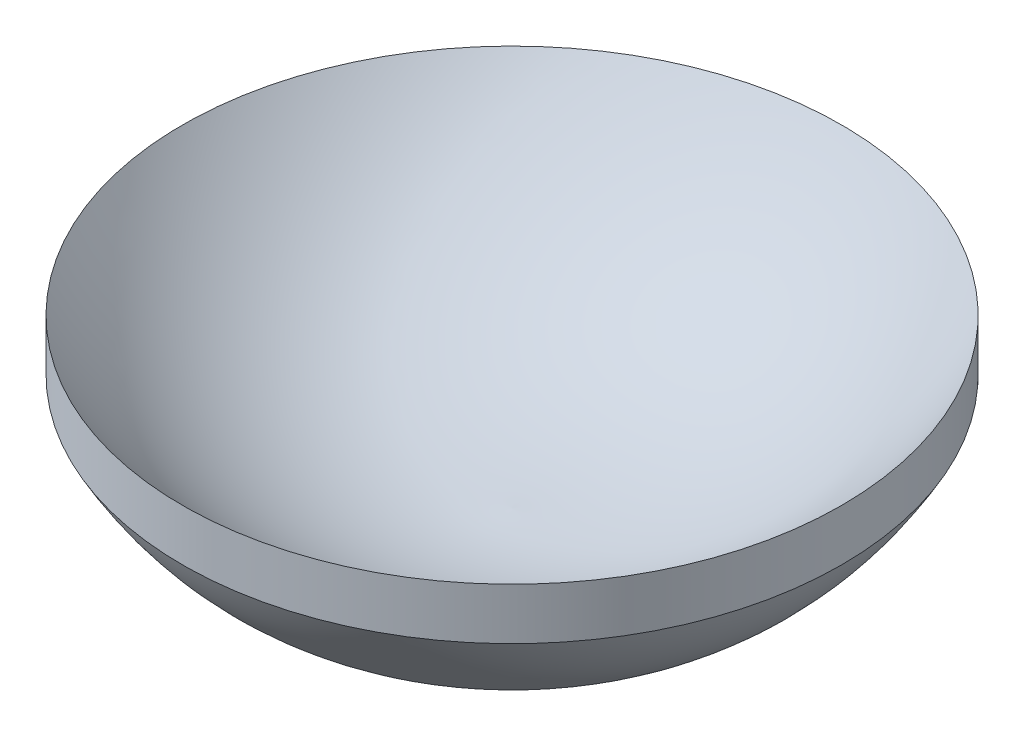
from build123d import *


with BuildPart() as part:
    # Sketch1 → Revolve1 (revolve)
    with BuildSketch(Plane.XY):
        with BuildLine():
            Line((0, 0), (0, 38.1))
            add(Edge.make_bspline(
                [(0, 38.1), (207.140771479, 29.946956963), (325.12, 203.2)],
                knots=[0, 0, 0, 1, 1, 1], degree=2))
            Line((325.12, 203.2), (325.12, 152.4))
            add(Edge.make_bspline(
                [(0, 0), (226.295545369, -25.093549204), (325.12, 152.4)],
                knots=[0, 0, 0, 1, 1, 1], degree=2))
        make_face()
    revolve(axis=Axis((0, 0, 0), (0, 1, 0)))


solid = part.part
